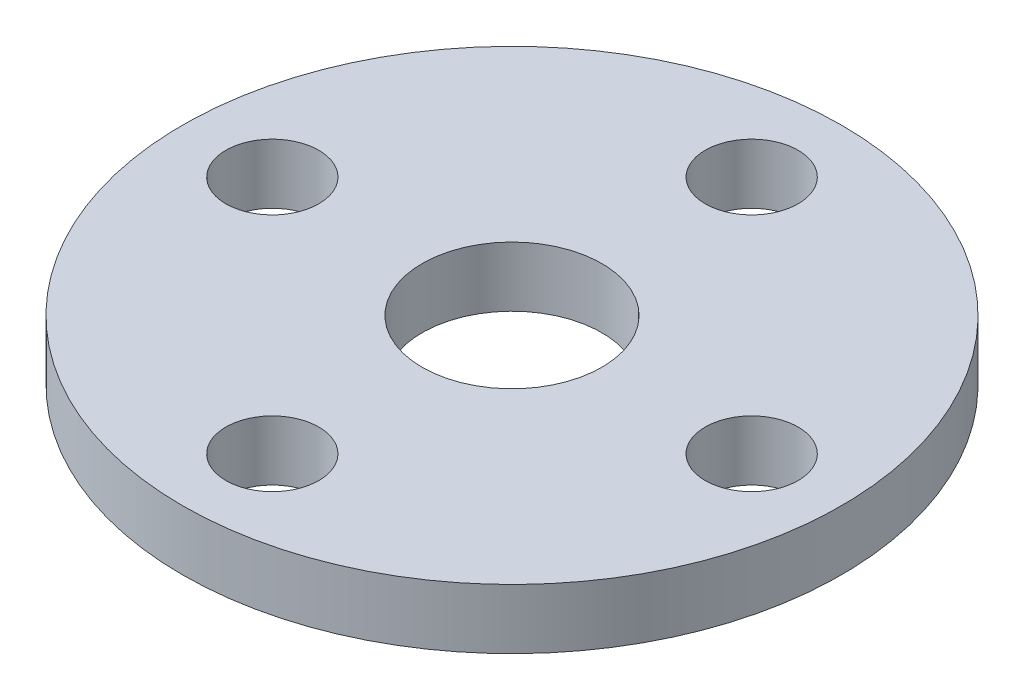
from build123d import *

# Parameters (mm, degrees)
SKETCH_1_R      = 11
SKETCH_1_R_2    = 1.55
SKETCH_1_R_3    = 3
EXTRUDE_1_DEPTH = 2


with BuildPart() as part:
    # 草圖1 → 填料-伸長1 (new body)
    with BuildSketch(Plane(origin=(0, 0, 0), x_dir=(1, 0, 0), z_dir=(0, 1, 0))):
        with Locations(Location((0, 0, 0), (0, 0, 270))):
            Circle(SKETCH_1_R)
        with Locations(Location((0, 8, 0), (0, 0, 270))):
            Circle(SKETCH_1_R_2, mode=Mode.SUBTRACT)
        with Locations(Location((8, 0, 0), (0, 0, 270))):
            Circle(SKETCH_1_R_2, mode=Mode.SUBTRACT)
        with Locations(Location((0, -8, 0), (0, 0, 270))):
            Circle(SKETCH_1_R_2, mode=Mode.SUBTRACT)
        with Locations(Location((-8, 0, 0), (0, 0, 270))):
            Circle(SKETCH_1_R_2, mode=Mode.SUBTRACT)
        with Locations(Location((0, 0, 0), (0, 0, 270))):
            Circle(SKETCH_1_R_3, mode=Mode.SUBTRACT)
    extrude(amount=EXTRUDE_1_DEPTH)


solid = part.part
